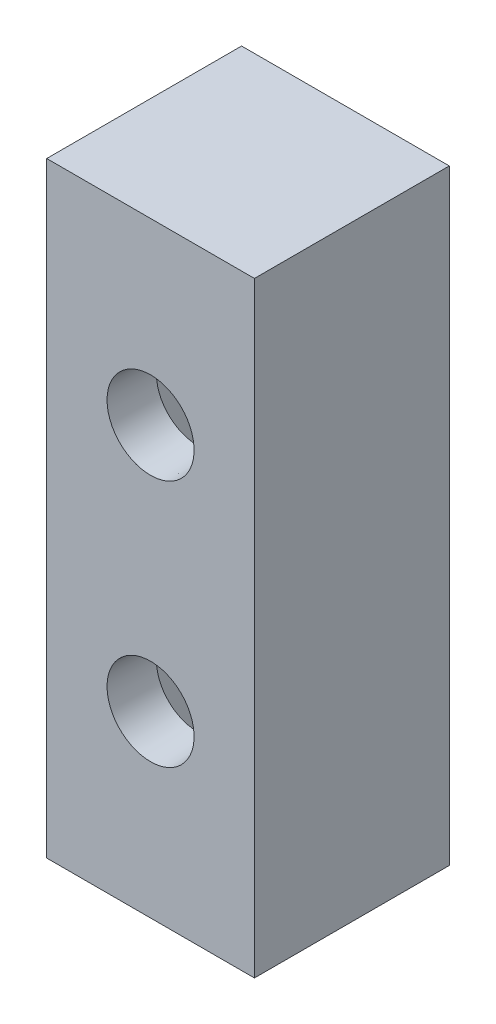
from build123d import *

# Parameters (mm, degrees)
SKETCH1_W                    = 9.525
SKETCH1_H                    = 32
BOSS_EXTRUDE1_DEPTH          = 3
SKETCH2_W                    = 11.725
SKETCH2_H                    = 34.2
SKETCH2_W_2                  = 9.525
SKETCH2_H_2                  = 32
BOSS_EXTRUDE2_DEPTH          = 11
SKETCH3_R                    = 2.3
CUT_EXTRUDE1_DEPTH           = 69.046312354
CUT_EXTRUDE1_DRAFT           = 3
CUT_EXTRUDE1_PROFILE_2_DEPTH = 69.046312354
CUT_EXTRUDE1_PROFILE_2_DRAFT = 3
MOVE_FACE1_BY                = 0.35
MOVE_FACE1_2_BY              = 0.35
MOVE_FACE1_3_BY              = 0.35
MOVE_FACE1_4_BY              = 0.35
MOVE_FACE1_5_BY              = 0.35


with BuildPart() as part:
    # Sketch1 → Boss-Extrude1 (new body)
    with BuildSketch(Plane.XY):
        with Locations((59.5125, 0)):
            Rectangle(SKETCH1_W, SKETCH1_H)
    extrude(amount=BOSS_EXTRUDE1_DEPTH)

    # Sketch2 → Boss-Extrude2 (add)
    with BuildSketch(Plane.XY.offset(3)):
        with Locations((59.5125, 0)):
            Rectangle(SKETCH2_W, SKETCH2_H)
        with Locations((59.5125, 0)):
            Rectangle(SKETCH2_W_2, SKETCH2_H_2, mode=Mode.SUBTRACT)
    extrude(amount=-BOSS_EXTRUDE2_DEPTH)


with BuildPart() as cut_extrude1_tool:
    # Sketch3 → Cut-Extrude1 (with draft: the straight prism first)
    with BuildSketch(Plane(origin=(0, 0, 0), x_dir=(-1, 0, 0), z_dir=(0, 0, -1))):
        with Locations((-59.5125, 7)):
            Circle(SKETCH3_R)
    extrude(amount=-CUT_EXTRUDE1_DEPTH)
    # Cut-Extrude1: the draft: its side faces are tilted about the plane it starts from
    cut_extrude1_sides = [cut_extrude1_tool.faces().sort_by_distance(p)[0] for p in [
        (61.8125, 7, 34.523156177),
    ]]
    draft(cut_extrude1_sides, Plane(origin=(0, 0, 0), x_dir=(-1, 0, 0), z_dir=(0, 0, -1)), CUT_EXTRUDE1_DRAFT)


with BuildPart() as part_1:
    add(part.part)

    # Cut-Extrude1: cut by cut_extrude1_tool
    add(cut_extrude1_tool.part, mode=Mode.SUBTRACT)


with BuildPart() as cut_extrude1_profile_2_tool:
    # Sketch3 → Cut-Extrude1 profile 2 (with draft: the straight prism first)
    with BuildSketch(Plane(origin=(0, 0, 0), x_dir=(-1, 0, 0), z_dir=(0, 0, -1))):
        with Locations((-59.5125, -7)):
            Circle(SKETCH3_R)
    extrude(amount=-CUT_EXTRUDE1_PROFILE_2_DEPTH)
    # Cut-Extrude1 profile 2: the draft: its side faces are tilted about the plane it starts from
    cut_extrude1_profile_2_sides = [cut_extrude1_profile_2_tool.faces().sort_by_distance(p)[0] for p in [
        (61.8125, -7, 34.523156177),
    ]]
    draft(cut_extrude1_profile_2_sides, Plane(origin=(0, 0, 0), x_dir=(-1, 0, 0), z_dir=(0, 0, -1)), CUT_EXTRUDE1_PROFILE_2_DRAFT)


with BuildPart() as part_2:
    add(part_1.part)

    # Cut-Extrude1 profile 2: cut by cut_extrude1_profile_2_tool
    add(cut_extrude1_profile_2_tool.part, mode=Mode.SUBTRACT)

    # Move Face1: a face moved inward by 0.35
    extrude(part_2.faces().sort_by_distance((59.5125, -16, -4))[0], amount=MOVE_FACE1_BY, dir=(0, -1, 0), mode=Mode.SUBTRACT)

    # Move Face1 2: a face moved inward by 0.35
    extrude(part_2.faces().sort_by_distance((54.75, 0, -4))[0], amount=MOVE_FACE1_2_BY, dir=(-1, 0, 0), mode=Mode.SUBTRACT)

    # Move Face1 3: a face moved inward by 0.35
    extrude(part_2.faces().sort_by_distance((64.275, 0, -4))[0], amount=MOVE_FACE1_3_BY, dir=(1, 0, 0), mode=Mode.SUBTRACT)

    # Move Face1 4: a face moved inward by 0.35
    extrude(part_2.faces().sort_by_distance((59.5125, 16, -4))[0], amount=MOVE_FACE1_4_BY, dir=(0, 1, 0), mode=Mode.SUBTRACT)

    # Move Face1 5: a face moved inward by 0.35
    extrude(part_2.faces().sort_by_distance((59.5125, 0, 0))[0], amount=MOVE_FACE1_5_BY, dir=(0, 0, 1), mode=Mode.SUBTRACT)


solid = part_2.part
